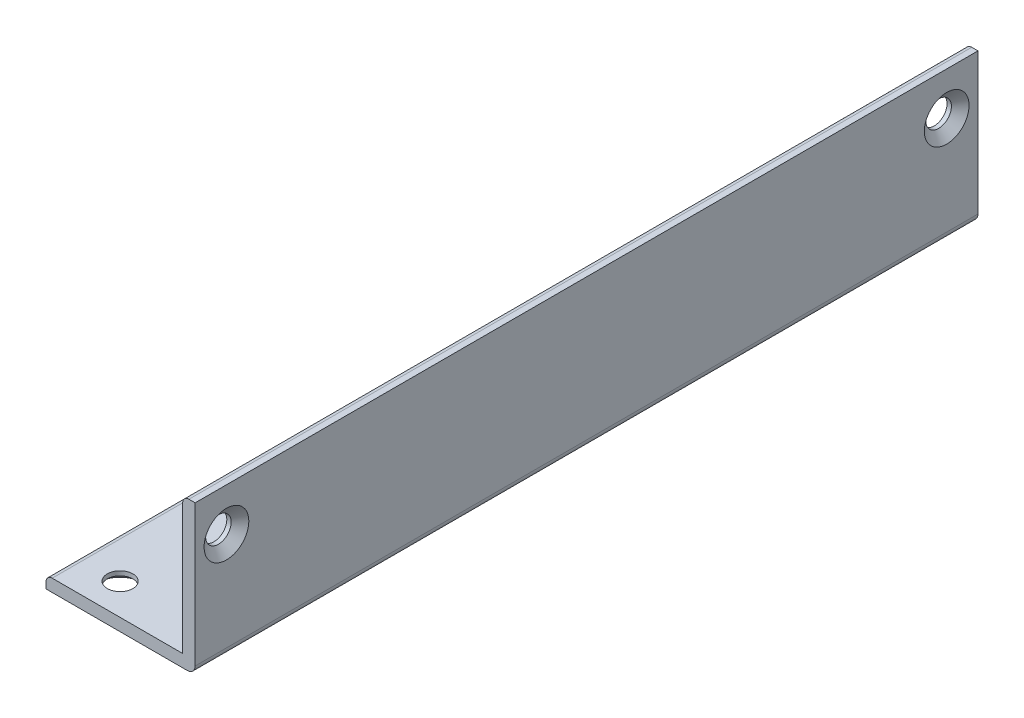
from build123d import *

# Parameters (mm, degrees)
BOSS_EXTRUDE1_DEPTH                               = 50
CSK_FOR_4_FLAT_HEAD_MACHINE_SCREW_100_D           = 3.2639
CSK_FOR_4_FLAT_HEAD_MACHINE_SCREW_100_CSINK_D     = 5.715
CSK_FOR_4_FLAT_HEAD_MACHINE_SCREW_100_CSINK_ANGLE = 100
CSK_FOR_4_FLAT_HEAD_MACHINE_SCREW_2_D             = 3.2639
CSK_FOR_4_FLAT_HEAD_MACHINE_SCREW_2_CSINK_D       = 5.715
CSK_FOR_4_FLAT_HEAD_MACHINE_SCREW_2_CSINK_ANGLE   = 100
FILLET1_R                                         = 1
CUT_EXTRUDE1_DEPTH                                = 25


with BuildPart() as part:
    # Sketch2 → Boss-Extrude1 (new, symmetric)
    with BuildSketch(Plane.XY):
        with BuildLine():
            Line((-9.525, 0), (9.525, 0))
            Line((9.525, 0), (9.525, 19.05))
            Line((9.525, 19.05), (8.73125, 19.05))
            ThreePointArc((8.73125, 19.05), (8.169983992, 18.817516008), (7.9375, 18.25625))
            Line((7.9375, 18.25625), (7.9375, 2.38125))
            ThreePointArc((7.9375, 2.38125), (7.705016008, 1.819983992), (7.14375, 1.5875))
            Line((7.14375, 1.5875), (-8.73125, 1.5875))
            ThreePointArc((-8.73125, 1.5875), (-9.292516008, 1.355016008), (-9.525, 0.79375))
            Line((-9.525, 0.79375), (-9.525, 0))
        make_face()
    extrude(amount=BOSS_EXTRUDE1_DEPTH, both=True)

    # CSK for _4 Flat Head Machine Screw _100 (through all)
    with Locations(Plane(origin=(0, 0, 0), x_dir=(-1, 0, 0), z_dir=(0, -1, 0))):
        with Locations((4.0625, -46), (4.0625, 46)):
            CounterSinkHole(CSK_FOR_4_FLAT_HEAD_MACHINE_SCREW_100_D / 2, CSK_FOR_4_FLAT_HEAD_MACHINE_SCREW_100_CSINK_D / 2, counter_sink_angle=CSK_FOR_4_FLAT_HEAD_MACHINE_SCREW_100_CSINK_ANGLE)

    # CSK for _4 Flat Head Machine Screw _ 2 (through all)
    with Locations(Plane(origin=(9.525, 0, 0), x_dir=(0, 0, -1), z_dir=(1, 0, 0))):
        with Locations((-46, 13.5875), (46, 13.5875)):
            CounterSinkHole(CSK_FOR_4_FLAT_HEAD_MACHINE_SCREW_2_D / 2, CSK_FOR_4_FLAT_HEAD_MACHINE_SCREW_2_CSINK_D / 2, counter_sink_angle=CSK_FOR_4_FLAT_HEAD_MACHINE_SCREW_2_CSINK_ANGLE)

    # Fillet1
    fillet1_edges = [part.edges().sort_by_distance(p)[0] for p in [
        (9.525, 0, 0),
    ]]
    fillet(fillet1_edges, radius=FILLET1_R)

    # Sketch24 → Cut-Extrude1 (cut)
    with BuildSketch(Plane.XY.offset(50)):
        Polygon((2.9375, 1.5875), (7.9375, 6.5875), (7.9375, 1.5875), align=None)
    cut_extrude1 = extrude(amount=-CUT_EXTRUDE1_DEPTH, mode=Mode.SUBTRACT)

    # Mirror1: Cut-Extrude1 across plane
    add(cut_extrude1.mirror(Plane.XY), mode=Mode.SUBTRACT)


solid = part.part
